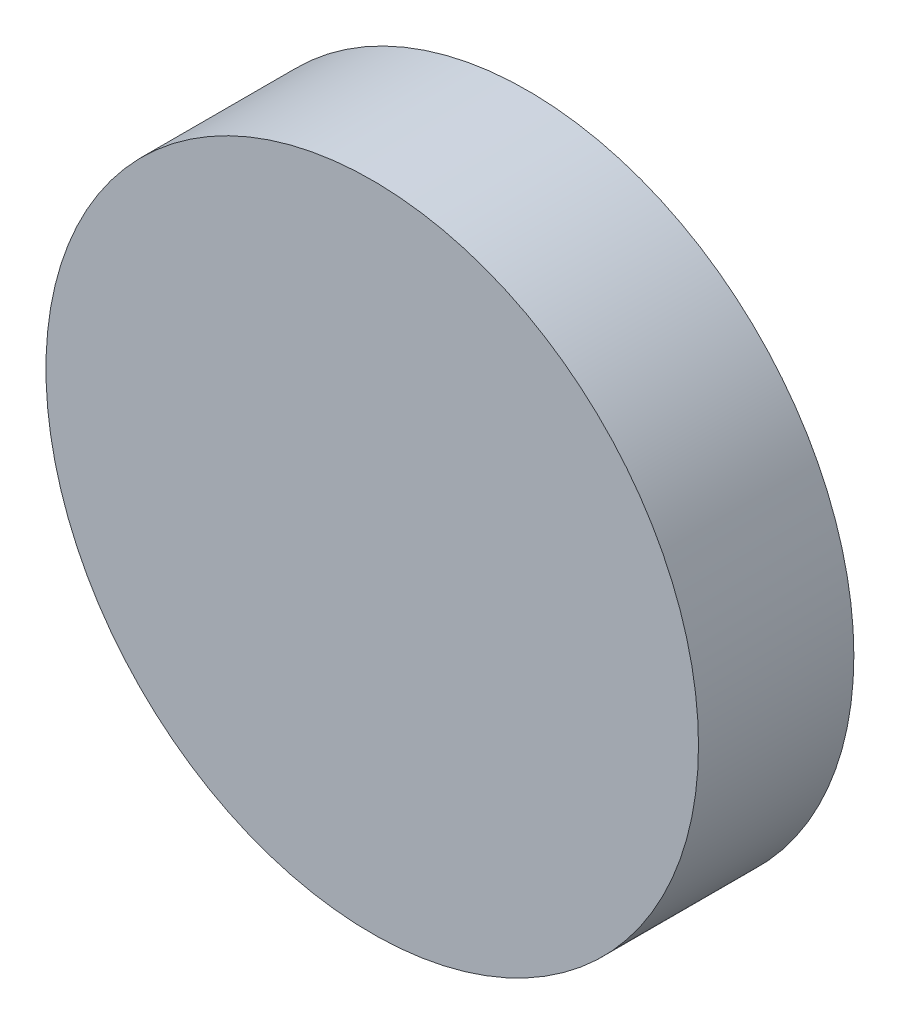
from build123d import *

# Parameters (mm, degrees)
SKETCH1_R           = 21
BOSS_EXTRUDE1_DEPTH = 10


with BuildPart() as part:
    # Sketch1 → Boss-Extrude1 (new body)
    with BuildSketch(Plane.XY):
        Circle(SKETCH1_R)
    extrude(amount=BOSS_EXTRUDE1_DEPTH)


solid = part.part
